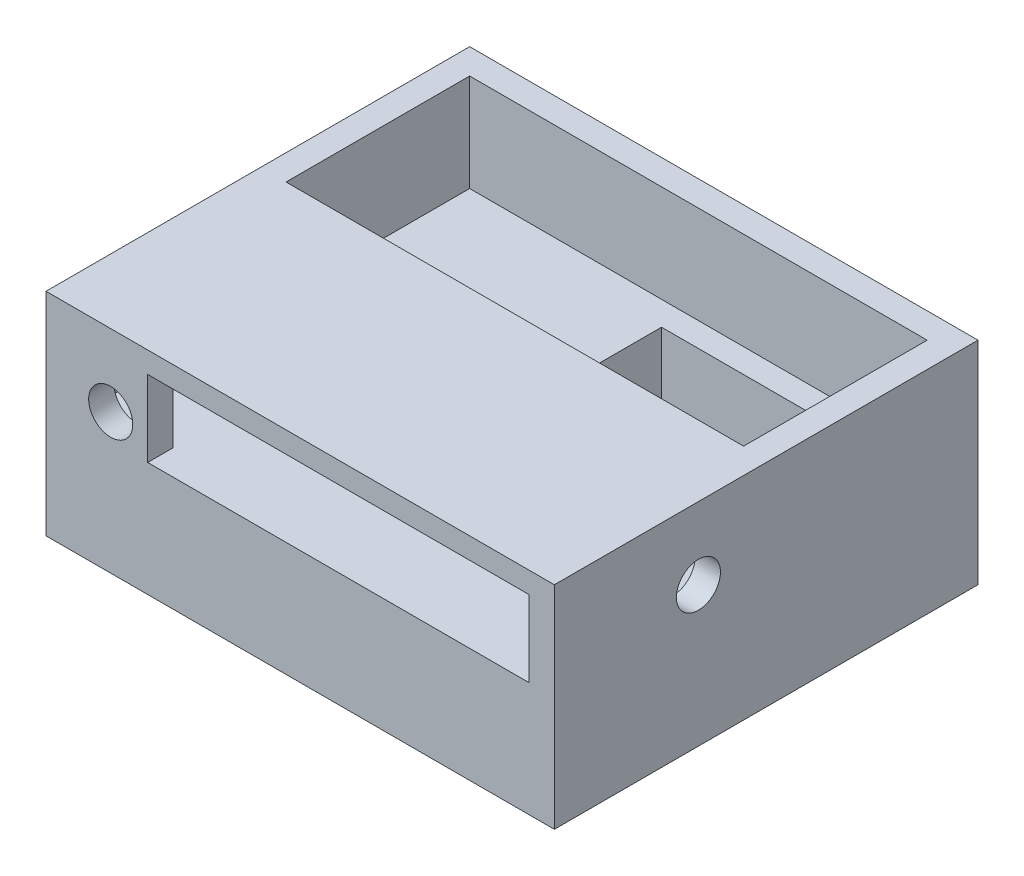
from build123d import *

# Parameters (mm, degrees)
ESQUISSE1_W             = 60
ESQUISSE1_H             = 50
BOSS_EXTRU_1_DEPTH      = 20
ESQUISSE2_W             = 54
ESQUISSE2_H             = 44
ENL_V_MAT_EXTRU_1_DEPTH = 11.5
ENL_V_MAT_EXTRU_2_REACH = 80.945
ESQUISSE3_W             = 23
ESQUISSE3_H             = 12.3
ESQUISSE4_R             = 2.6
ENL_V_MAT_EXTRU_3_DEPTH = 10
ESQUISSE5_W             = 60
ESQUISSE5_H             = 50
ESQUISSE5_W_2           = 33
ESQUISSE5_H_2           = 12.3
BOSS_EXTRU_2_DEPTH      = 5
ESQUISSE6_R             = 2.6
ENL_V_MAT_EXTRU_4_DEPTH = 10
ESQUISSE8_W             = 60
ESQUISSE8_H             = 25.332095198
BOSS_EXTRU_3_DEPTH      = 2.5
ESQUISSE9_W             = 45
ESQUISSE9_H             = 9
ENL_V_MAT_EXTRU_6_DEPTH = 3


with BuildPart() as part:
    # Esquisse1 → Boss.-Extru.1 (new body)
    with BuildSketch(Plane(origin=(0, 0, 0), x_dir=(1, 0, 0), z_dir=(0, 1, 0))):
        with Locations((30, -25)):
            Rectangle(ESQUISSE1_W, ESQUISSE1_H)
    extrude(amount=BOSS_EXTRU_1_DEPTH)

    # Esquisse2 → Enlèv. mat.-Extru.1 (cut)
    with BuildSketch(Plane(origin=(0, 20, 0), x_dir=(1, 0, 0), z_dir=(0, 1, 0))):
        with Locations((30, -25)):
            Rectangle(ESQUISSE2_W, ESQUISSE2_H)
    extrude(amount=-ENL_V_MAT_EXTRU_1_DEPTH, mode=Mode.SUBTRACT)

    # Esquisse3 → Enlèv. mat.-Extru.2 (cut, up to next)
    with BuildSketch(Plane(origin=(0, 8.5, 0), x_dir=(1, 0, 0), z_dir=(0, 1, 0)), mode=Mode.PRIVATE) as enl_v_mat_extru_2_sk1:
        with Locations((40, -12)):
            Rectangle(ESQUISSE3_W, ESQUISSE3_H)
    enl_v_mat_extru_2_tool1 = extrude(enl_v_mat_extru_2_sk1.sketch, amount=-ENL_V_MAT_EXTRU_2_REACH, mode=Mode.PRIVATE) & part.part
    add(enl_v_mat_extru_2_tool1.solids().sort_by_distance((40, 8.5, 12))[0], mode=Mode.SUBTRACT)

    # Esquisse4 → Enlèv. mat.-Extru.3 (cut)
    with BuildSketch(Plane(origin=(60, 0, 0), x_dir=(0, 0, -1), z_dir=(1, 0, 0))):
        with Locations((-33, 11.5)):
            Circle(ESQUISSE4_R)
    extrude(amount=-ENL_V_MAT_EXTRU_3_DEPTH, mode=Mode.SUBTRACT)

    # Esquisse5 → Boss.-Extru.2 (add)
    with BuildSketch(Plane.XZ):
        with Locations((30, 25)):
            Rectangle(ESQUISSE5_W, ESQUISSE5_H)
        with Locations((40, 12)):
            Rectangle(ESQUISSE5_W_2, ESQUISSE5_H_2, mode=Mode.SUBTRACT)
    extrude(amount=BOSS_EXTRU_2_DEPTH)

    # Esquisse6 → Enlèv. mat.-Extru.4 (cut)
    with BuildSketch(Plane.XY.offset(50)):
        with Locations((7.636251233, 11.492300727)):
            Circle(ESQUISSE6_R)
    extrude(amount=-ENL_V_MAT_EXTRU_4_DEPTH, mode=Mode.SUBTRACT)

    # Esquisse8 → Boss.-Extru.3 (add)
    with BuildSketch(Plane(origin=(0, 20, 0), x_dir=(1, 0, 0), z_dir=(0, 1, 0))):
        with Locations((30, -37.333952401)):
            Rectangle(ESQUISSE8_W, ESQUISSE8_H)
    extrude(amount=-BOSS_EXTRU_3_DEPTH)

    # Esquisse9 → Enlèv. mat.-Extru.6 (cut)
    with BuildSketch(Plane.XY.offset(50)):
        with Locations((34.5, 13)):
            Rectangle(ESQUISSE9_W, ESQUISSE9_H)
    extrude(amount=-ENL_V_MAT_EXTRU_6_DEPTH, mode=Mode.SUBTRACT)


solid = part.part
